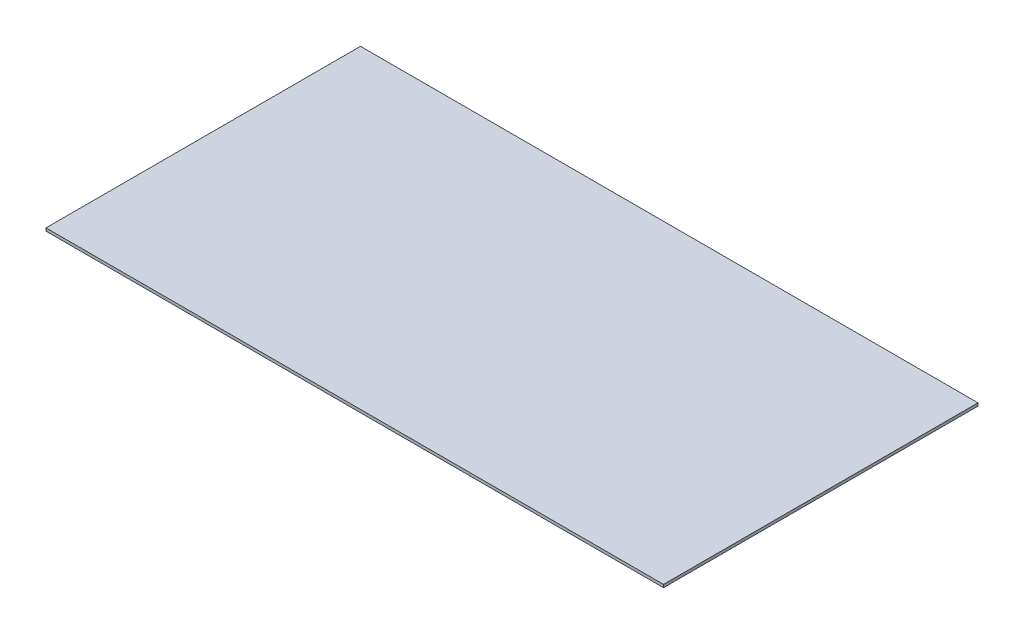
from build123d import *

# Parameters (mm, degrees)
SKETCH1_W           = 685.8
SKETCH1_H           = 349.25
BOSS_EXTRUDE1_DEPTH = 3.175


with BuildPart() as part:
    # Sketch1 → Boss-Extrude1 (new body)
    with BuildSketch(Plane(origin=(0, 0, 0), x_dir=(1, 0, 0), z_dir=(0, 1, 0))):
        with Locations((184.837783375, -117.40302267)):
            Rectangle(SKETCH1_W, SKETCH1_H)
    extrude(amount=BOSS_EXTRUDE1_DEPTH)


solid = part.part
